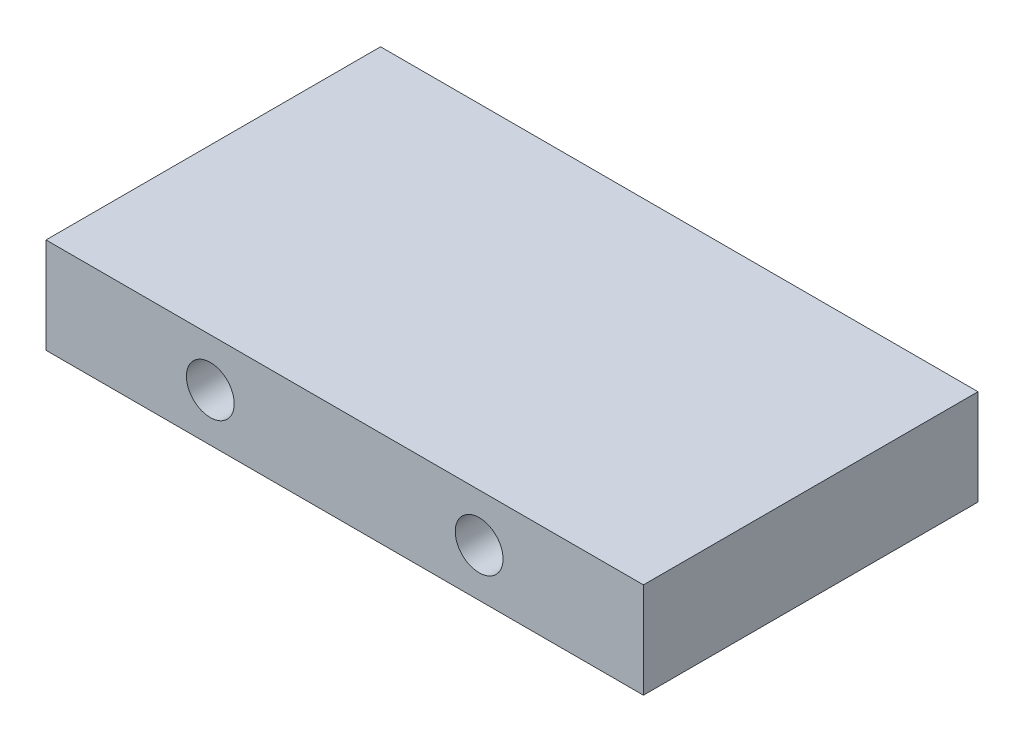
from build123d import *

# Parameters (mm, degrees)
SKETCH1_W           = 50
SKETCH1_H           = 8
SKETCH1_R           = 2
BOSS_EXTRUDE1_DEPTH = 28


with BuildPart() as part:
    # Sketch1 → Boss-Extrude1 (new body)
    with BuildSketch(Plane.XY):
        Rectangle(SKETCH1_W, SKETCH1_H)
        with Locations((-11.25, 0)):
            Circle(SKETCH1_R, mode=Mode.SUBTRACT)
        with Locations((11.25, 0)):
            Circle(SKETCH1_R, mode=Mode.SUBTRACT)
    extrude(amount=BOSS_EXTRUDE1_DEPTH)


solid = part.part
